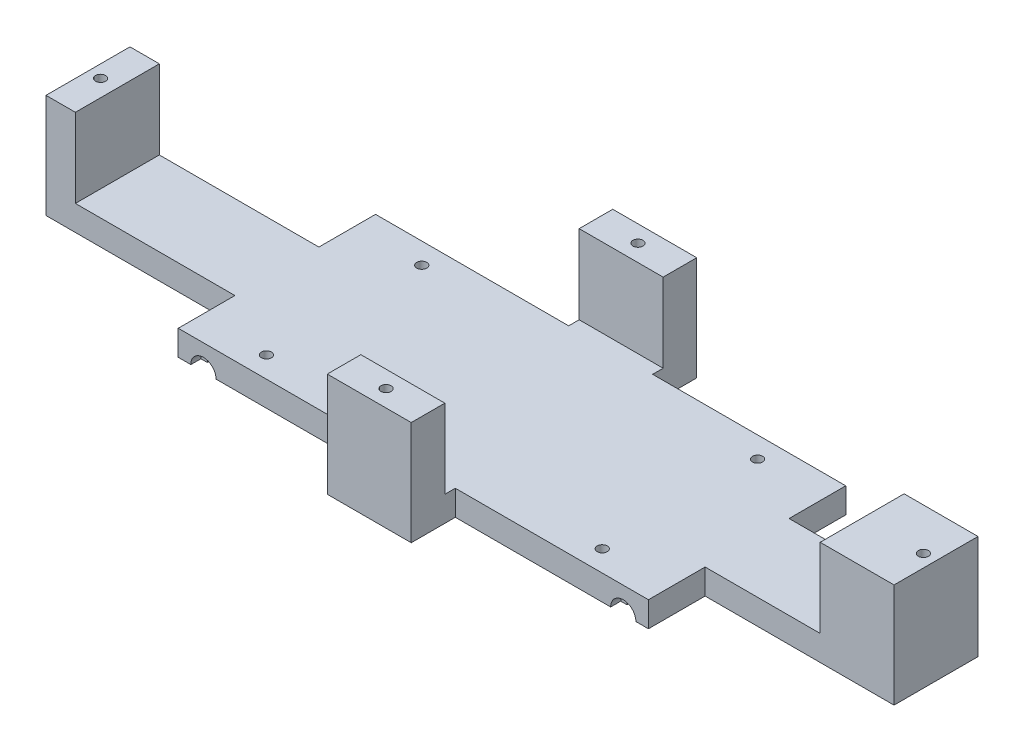
from build123d import *

# Parameters (mm, degrees)
SKETCH_1_W          = 56
SKETCH_1_H          = 23.5
SKETCH_1_R          = 0.6
EXTRUDE_1_DEPTH     = 3
SKETCH_2_R          = 0.75
CUT_EXTRUDE_1_DEPTH = 37.67764987
SKETCH_2_3_R        = 1.5
SKETCH_2_3_R_2      = 0.75
CUT_EXTRUDE_2_DEPTH = 1.2
CUT_EXTRUDE_START   = -22.3
SKETCH_2_4_R        = 1.5
SKETCH_2_4_R_2      = 0.75
CUT_EXTRUDE_3_DEPTH = 1.2
SKETCH_3_W          = 22.5
SKETCH_3_H          = 10
SKETCH_3_W_2        = 10
SKETCH_3_H_2        = 34
EXTRUDE_2_DEPTH     = 12.4
SKETCH_4_R          = 0.6
CUT_EXTRUDE_4_DEPTH = 2
SKETCH_5_W          = 84.5
SKETCH_5_H          = 26
SKETCH_5_W_2        = 4.2
SKETCH_5_H_2        = 15.1
CUT_EXTRUDE_5_DEPTH = 9.4


with BuildPart() as part:
    # 草图1 → 凸台-拉伸1 (new body)
    with BuildSketch(Plane(origin=(0, 0, 0), x_dir=(1, 0, 0), z_dir=(0, 1, 0))):
        Rectangle(SKETCH_1_W, SKETCH_1_H)
        with Locations(Location((-20, 9.25, 0), (0, 0, 270))):
            Circle(SKETCH_1_R, mode=Mode.SUBTRACT)
        with Locations(Location((-20, -9.25, 0), (0, 0, 270))):
            Circle(SKETCH_1_R, mode=Mode.SUBTRACT)
        with Locations(Location((20, 9.25, 0), (0, 0, 270))):
            Circle(SKETCH_1_R, mode=Mode.SUBTRACT)
        with Locations(Location((20, -9.25, 0), (0, 0, 270))):
            Circle(SKETCH_1_R, mode=Mode.SUBTRACT)
    extrude(amount=EXTRUDE_1_DEPTH)

    # 草图2 → 切除-拉伸1 (cut, through all)
    with BuildSketch(Plane.XY.offset(11.75)):
        with Locations((-25, 0)):
            Circle(SKETCH_2_R)
        with Locations((25, 0)):
            Circle(SKETCH_2_R)
    extrude(amount=-CUT_EXTRUDE_1_DEPTH, mode=Mode.SUBTRACT)

    # 草图2<3> → 切除-拉伸2 (cut)
    # profile 1 of 2: a face of its own
    with BuildSketch(Plane.XY.offset(11.75)):
        with Locations((-25, 0)):
            Circle(SKETCH_2_3_R)
        with Locations((-25, 0)):
            Circle(SKETCH_2_3_R_2, mode=Mode.SUBTRACT)
    # profile 2 of 2: a face of its own
    with BuildSketch(Plane.XY.offset(11.75)):
        with Locations((25, 0)):
            Circle(SKETCH_2_3_R)
        with Locations((25, 0)):
            Circle(SKETCH_2_3_R_2, mode=Mode.SUBTRACT)
    extrude(amount=-CUT_EXTRUDE_2_DEPTH, mode=Mode.SUBTRACT)

    # 草图2<4> → 切除-拉伸3 (cut)
    # profile 1 of 2: a face of its own
    with BuildSketch(Plane.XY.offset(11.75).offset(CUT_EXTRUDE_START)):
        with Locations((-25, 0)):
            Circle(SKETCH_2_4_R)
        with Locations((-25, 0)):
            Circle(SKETCH_2_4_R_2, mode=Mode.SUBTRACT)
    # profile 2 of 2: a face of its own
    with BuildSketch(Plane.XY.offset(11.75).offset(CUT_EXTRUDE_START)):
        with Locations((25, 0)):
            Circle(SKETCH_2_4_R)
        with Locations((25, 0)):
            Circle(SKETCH_2_4_R_2, mode=Mode.SUBTRACT)
    extrude(amount=-CUT_EXTRUDE_3_DEPTH, mode=Mode.SUBTRACT)

    # 草图3 → 凸台-拉伸2 (add)
    with BuildSketch(Plane.XZ):
        with Locations((-39.25, 0)):
            Rectangle(SKETCH_3_W, SKETCH_3_H)
        with Locations((39.25, 0)):
            Rectangle(SKETCH_3_W, SKETCH_3_H)
        Rectangle(SKETCH_3_W_2, SKETCH_3_H_2)
    extrude(amount=-EXTRUDE_2_DEPTH)

    # 草图4 → 切除-拉伸4 (cut)
    with BuildSketch(Plane(origin=(0, 12.4, 0), x_dir=(1, 0, 0), z_dir=(0, 1, 0))):
        with Locations(Location((0, 15, 0), (0, 0, 270))):
            Circle(SKETCH_4_R)
        with Locations(Location((0, -15, 0), (0, 0, 270))):
            Circle(SKETCH_4_R)
        with Locations(Location((49, 0, 0), (0, 0, 270))):
            Circle(SKETCH_4_R)
        with Locations(Location((-49, 0, 0), (0, 0, 270))):
            Circle(SKETCH_4_R)
    extrude(amount=-CUT_EXTRUDE_4_DEPTH, mode=Mode.SUBTRACT)

    # 草图5 → 切除-拉伸5 (cut)
    with BuildSketch(Plane(origin=(0, 12.4, 0), x_dir=(1, 0, 0), z_dir=(0, 1, 0))):
        with Locations((-0.55, 0)):
            Rectangle(SKETCH_5_W, SKETCH_5_H)
        with Locations((-44.9, 0.45)):
            Rectangle(SKETCH_5_W_2, SKETCH_5_H_2)
    extrude(amount=-CUT_EXTRUDE_5_DEPTH, mode=Mode.SUBTRACT)


solid = part.part
